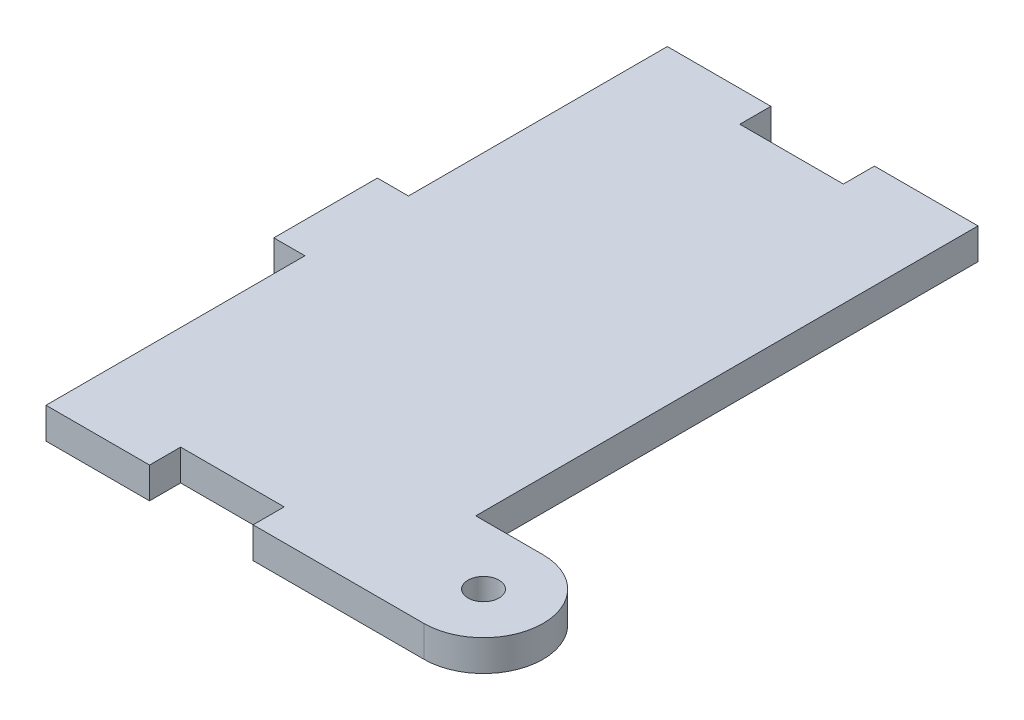
from build123d import *

# Parameters (mm, degrees)
SKETCH1_R           = 1.5
BOSS_EXTRUDE1_DEPTH = 3


with BuildPart() as part:
    # Sketch1 → Boss-Extrude1 (new body)
    with BuildSketch(Plane(origin=(0, 0, 0), x_dir=(1, 0, 0), z_dir=(0, 1, 0))):
        with BuildLine():
            Line((21.5, -18.5), (15, -18.5))
            Line((15, -18.5), (15, -5))
            Line((15, -5), (15, 30))
            Line((15, 30), (5, 30))
            Line((5, 30), (5, 27))
            Line((5, 27), (-5, 27))
            Line((-5, 27), (-5, 30))
            Line((-5, 30), (-15, 30))
            Line((-15, 30), (-15, 5))
            Line((-15, 5), (-18, 5))
            Line((-18, 5), (-18, -5))
            Line((-18, -5), (-15, -5))
            Line((-15, -5), (-15, -30))
            Line((-15, -30), (-5, -30))
            Line((-5, -30), (-5, -27))
            Line((-5, -27), (5, -27))
            Line((5, -27), (5, -30))
            Line((5, -30), (15, -30))
            Line((15, -30), (21.5, -30))
            ThreePointArc((21.5, -30), (27.25, -24.25), (21.5, -18.5))
        make_face()
        with Locations(Location((21.5, -24.25, 0), (0, 0, 270))):
            Circle(SKETCH1_R, mode=Mode.SUBTRACT)
    extrude(amount=BOSS_EXTRUDE1_DEPTH)


solid = part.part
